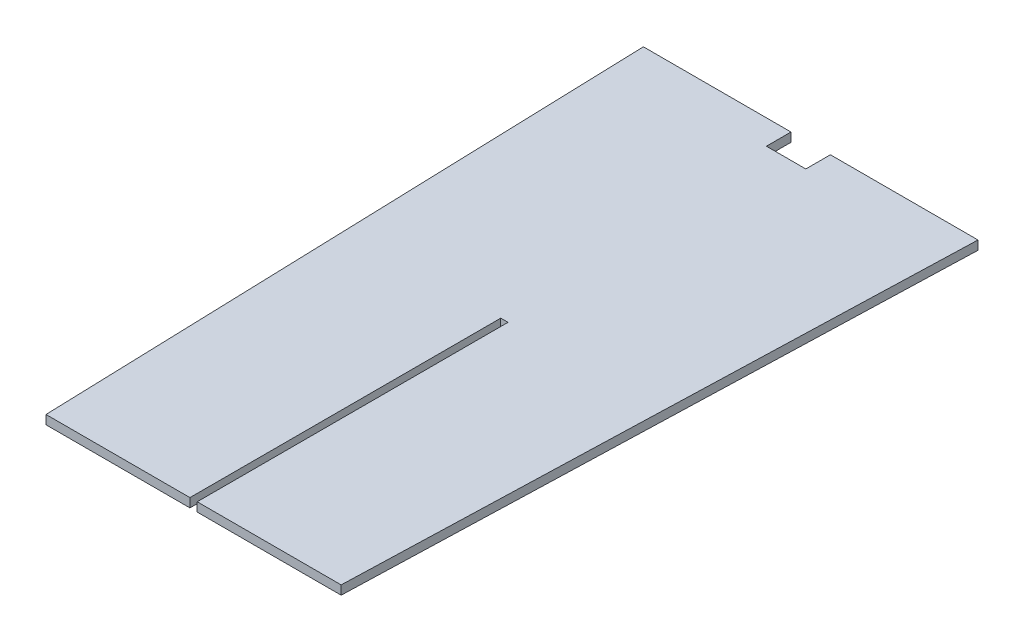
from build123d import *

# Parameters (mm, degrees)
BOSS_EXTRUDE1_DEPTH = 6.35


with BuildPart() as part:
    # Sketch1 → Boss-Extrude1 (new body)
    with BuildSketch(Plane(origin=(0, 0, 0), x_dir=(1, 0, 0), z_dir=(0, 1, 0))):
        Polygon((262.669201475, 448.360447089), (367.463251475, 448.360447089), (367.463251475, 430.897947089), (395.441351475, 430.897947089), (395.441351475, 448.360447089), (500.235401475, 448.360447089), (486.227301475, 10.210447089), (384.031988975, 10.210447089), (384.031988975, 230.872947089), (378.872613975, 230.872947089), (378.872613975, 10.210447089), (276.677301475, 10.210447089), align=None)
    extrude(amount=-BOSS_EXTRUDE1_DEPTH)


solid = part.part
